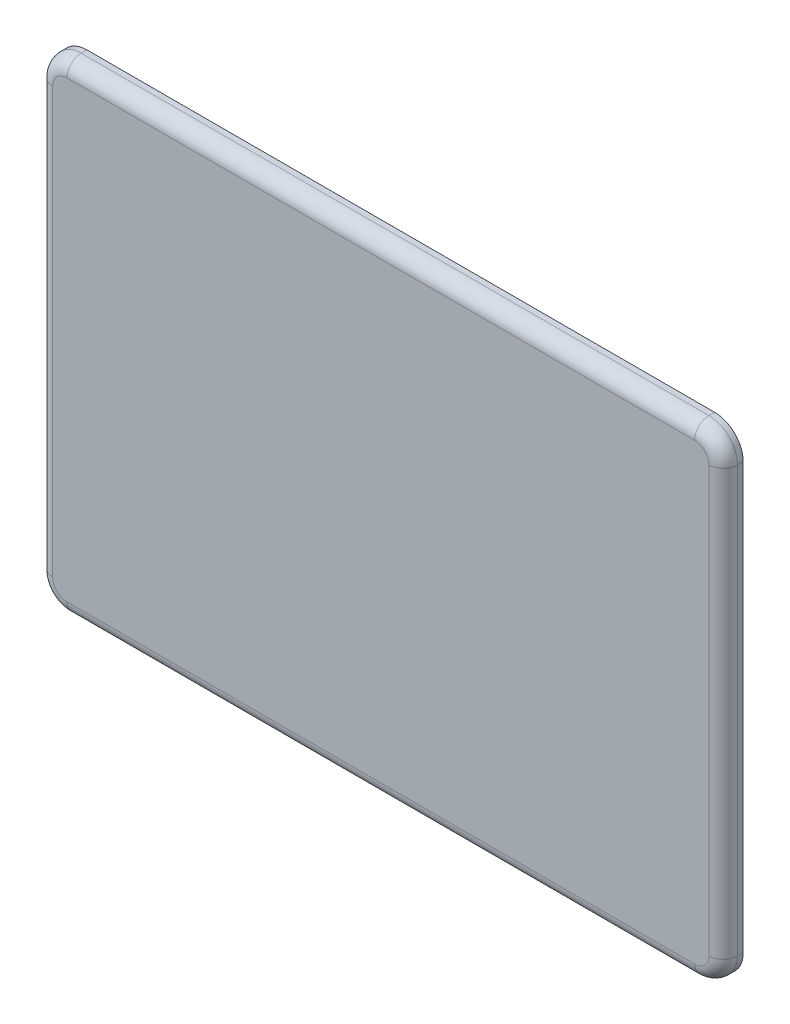
from build123d import *

# Parameters (mm, degrees)
BOSS_EXTRUDE1_DEPTH = 7
FILLET2_R           = 5
SKETCH2_W           = 170.284513749
SKETCH2_H           = 106.858227508
CUT_EXTRUDE1_DEPTH  = 2


with BuildPart() as part:
    # Sketch1 → Boss-Extrude1 (new body)
    with BuildSketch(Plane.XY):
        with BuildLine():
            Line((-176.117936118, 85.073710074), (43.882063882, 85.073710074))
            ThreePointArc((43.882063882, 85.073710074), (50.953131694, 82.144777886), (53.882063882, 75.073710074))
            Line((53.882063882, 75.073710074), (53.882063882, -73.926289926))
            ThreePointArc((53.882063882, -73.926289926), (50.953131694, -80.997357738), (43.882063882, -83.926289926))
            Line((43.882063882, -83.926289926), (-176.117936118, -83.926289926))
            ThreePointArc((-176.117936118, -83.926289926), (-183.18900393, -80.997357738), (-186.117936118, -73.926289926))
            Line((-186.117936118, -73.926289926), (-186.117936118, 75.073710074))
            ThreePointArc((-186.117936118, 75.073710074), (-183.18900393, 82.144777886), (-176.117936118, 85.073710074))
        make_face()
    extrude(amount=BOSS_EXTRUDE1_DEPTH)

    # Fillet2
    fillet2_edges = [part.edges().sort_by_distance(p)[0] for p in [
        (-183.18900393, -80.997357738, 7),
        (-66.117936118, -83.926289926, 7),
        (50.953131694, -80.997357738, 7),
        (53.882063882, 0.573710074, 7),
        (50.953131694, 82.144777886, 7),
        (-66.117936118, 85.073710074, 7),
        (-183.18900393, 82.144777886, 7),
        (-186.117936118, 0.573710074, 7),
    ]]
    fillet(fillet2_edges, radius=FILLET2_R)

    # Sketch2 → Cut-Extrude1 (cut, symmetric)
    with BuildSketch(Plane.XY.offset(3.5)):
        with Locations((-70.48620655, -6.89321053)):
            Rectangle(SKETCH2_W, SKETCH2_H)
    extrude(amount=CUT_EXTRUDE1_DEPTH, both=True, mode=Mode.SUBTRACT)


solid = part.part
